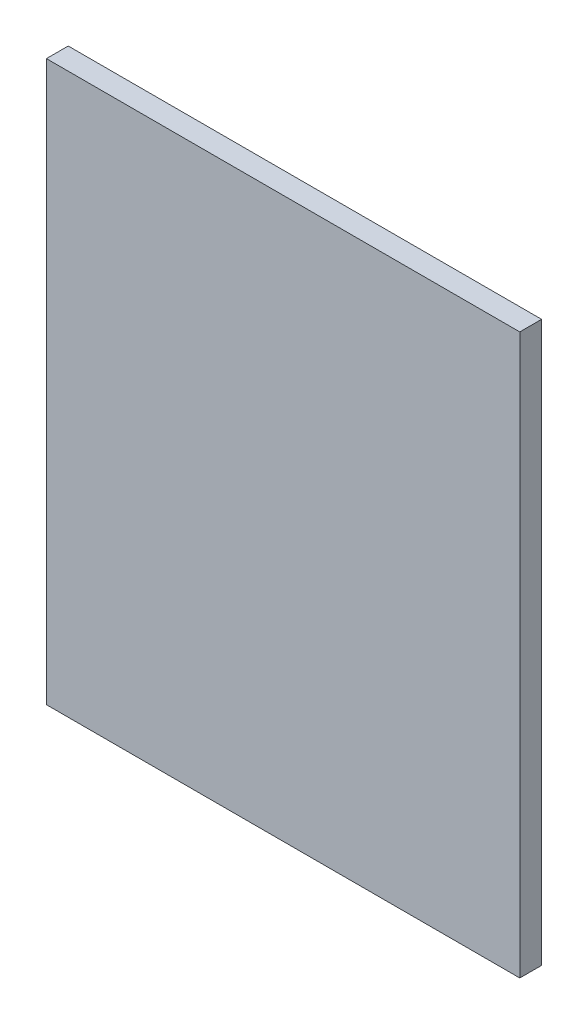
from build123d import *

# Parameters (mm, degrees)
BOSS_EXTRUDE1_DEPTH = 2
CUT_EXTRUDE1_DEPTH  = 104.743351649
SKETCH4_W           = 67.1
SKETCH4_H           = 9
BOSS_EXTRUDE2_DEPTH = 2
SKETCH5_W           = 23.5
SKETCH5_H           = 51.3
CUT_EXTRUDE2_DEPTH  = 10
SKETCH6_W           = 0.2
SKETCH6_H           = 51.3
CUT_EXTRUDE3_DEPTH  = 10


with BuildPart() as part:
    # Sketch2 → Boss-Extrude1 (new body)
    with BuildSketch(Plane.XY):
        Polygon((-88.945731411, -6.4), (-88.945731411, -1.9), (-93.645731411, -1.9), (-93.645731411, -44.6), (-26.145731411, -44.6), (-26.145731411, -1.9), (-70.145731411, -1.9), (-70.145731411, -6.4), align=None)
    extrude(amount=BOSS_EXTRUDE1_DEPTH)

    # Sketch3 → Cut-Extrude1 (cut, through all)
    with BuildSketch(Plane.XY.offset(2)):
        Polygon((-88.945731411, -1.9), (-93.645731411, -1.9), (-93.645731411, -44.6), (-26.145731411, -44.6), (-26.145731411, -1.9), (-70.145731411, -1.9), (-70.145731411, -6.4), (-88.945731411, -6.4), align=None)
        Polygon((-89.145731411, -2.1), (-93.445731411, -2.1), (-93.445731411, -44.4), (-26.345731411, -44.4), (-26.345731411, -2.1), (-69.945731411, -2.1), (-69.945731411, -6.6), (-89.145731411, -6.6), align=None, mode=Mode.SUBTRACT)
    extrude(amount=-CUT_EXTRUDE1_DEPTH, mode=Mode.SUBTRACT)

    # Sketch4 → Boss-Extrude2 (add)
    with BuildSketch(Plane.XY.offset(2)):
        with Locations((-59.895731411, -48.9)):
            Rectangle(SKETCH4_W, SKETCH4_H)
    extrude(amount=-BOSS_EXTRUDE2_DEPTH)

    # Sketch5 → Cut-Extrude2 (cut)
    with BuildSketch(Plane.XY.offset(2)):
        with Locations((-81.695731411, -27.75)):
            Rectangle(SKETCH5_W, SKETCH5_H)
    extrude(amount=-CUT_EXTRUDE2_DEPTH, mode=Mode.SUBTRACT)

    # Sketch6 → Cut-Extrude3 (cut)
    with BuildSketch(Plane.XY.offset(2)):
        with Locations((-69.845731411, -27.75)):
            Rectangle(SKETCH6_W, SKETCH6_H)
    extrude(amount=-CUT_EXTRUDE3_DEPTH, mode=Mode.SUBTRACT)


solid = part.part
